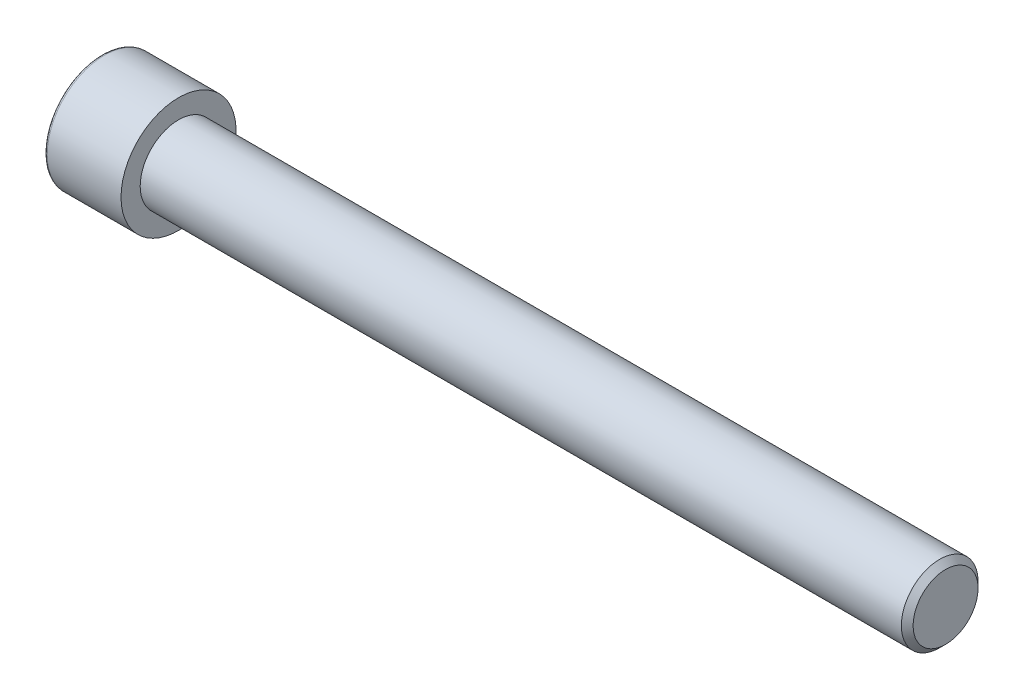
from build123d import *

# Parameters (mm, degrees)
SZKIC1_W                    = 16
SZKIC1_H                    = 12
SZKIC5_R                    = 9
DODANIE_WYCI_GNI_CIE1_DEPTH = 12


with BuildPart() as part:
    # Szkic1 → Obrót1 (revolve)
    with BuildSketch(Plane.XY):
        with Locations((8, 6)):
            Rectangle(SZKIC1_W, SZKIC1_H)
    revolve(axis=Axis((16, 0, 0), (-1, 0, 0)))

    # Szkic2 → Wycięcie-obrót1 (revolve, cut)
    with BuildSketch(Plane.XY):
        with BuildLine():
            Line((0, 12), (0, 11.4))
            ThreePointArc((0, 11.4), (0.175735931, 11.824264069), (0.6, 12))
            Line((0.6, 12), (0, 12))
        make_face()
    revolve(axis=Axis((16, 0, 0), (-1, 0, 0)), mode=Mode.SUBTRACT)

    # Szkic3 → Obrót2 (revolve)
    with BuildSketch(Plane.XY):
        Polygon((16, 0), (16, 8), (174.773, 8), (176, 6.773), (176, 0), align=None)
    revolve(axis=Axis((176, 0, 0), (-1, 0, 0)))

    # Szkic4 → Wycięcie-obrót2 (revolve, cut)
    with BuildSketch(Plane.XY):
        Polygon((0, 0), (0, 8.5), (8, 8.5), (12.907477288, 0), align=None)
    revolve(axis=Axis((12.907477288, 0, 0), (-1, 0, 0)), mode=Mode.SUBTRACT)

    # Szkic5 → Dodanie-wyciągnięcie1 (add)
    with BuildSketch(Plane(origin=(0, 0, 0), x_dir=(0, 0, -1), z_dir=(1, 0, 0))):
        Circle(SZKIC5_R)
        Polygon((-7, 4.041451884), (-7, -4.041451884), (0, -8.082903769), (7, -4.041451884), (7, 4.041451884), (0, 8.082903769), align=None, mode=Mode.SUBTRACT)
    extrude(amount=DODANIE_WYCI_GNI_CIE1_DEPTH)


solid = part.part
